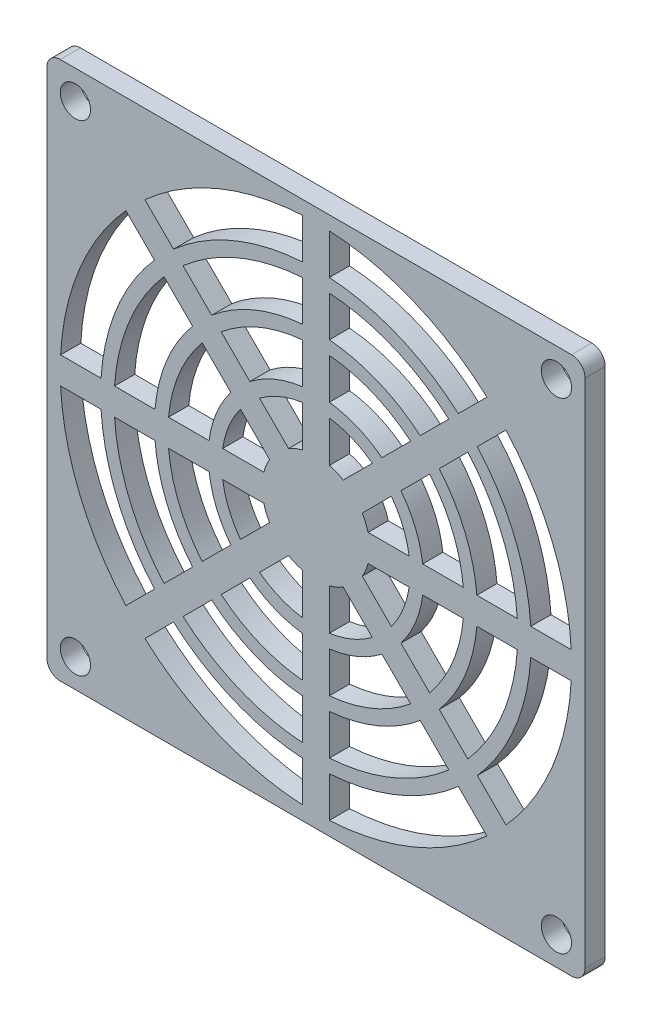
from build123d import *

# Parameters (mm, degrees)
SKETCH_1_R      = 2.25
EXTRUDE_1_DEPTH = 3


with BuildPart() as part:
    # 草图1 → 凸台-拉伸1 (new body)
    with BuildSketch(Plane.XY):
        with BuildLine():
            Line((-38, -40), (38, -40))
            ThreePointArc((38, -40), (39.414213562, -39.414213562), (40, -38))
            Line((40, -38), (40, 38))
            ThreePointArc((40, 38), (39.414213562, 39.414213562), (38, 40))
            Line((38, 40), (-38, 40))
            ThreePointArc((-38, 40), (-39.414213562, 39.414213562), (-40, 38))
            Line((-40, 38), (-40, -38))
            ThreePointArc((-40, -38), (-39.414213562, -39.414213562), (-38, -40))
        make_face()
        with Locations((-35.75, 35.75)):
            Circle(SKETCH_1_R, mode=Mode.SUBTRACT)
        with Locations((35.75, 35.75)):
            Circle(SKETCH_1_R, mode=Mode.SUBTRACT)
        with Locations((35.75, -35.75)):
            Circle(SKETCH_1_R, mode=Mode.SUBTRACT)
        with Locations((-35.75, -35.75)):
            Circle(SKETCH_1_R, mode=Mode.SUBTRACT)
        with BuildLine():
            Line((2, 37.947331922), (2, 31.937438845))
            ThreePointArc((2, 31.937438845), (12.245869836, 29.56414504), (21.168966019, 23.997393144))
            Line((21.168966019, 23.997393144), (25.418602168, 28.247029292))
            ThreePointArc((25.418602168, 28.247029292), (14.54197043, 35.107422235), (2, 37.947331922))
        make_face(mode=Mode.SUBTRACT)
        with BuildLine():
            Line((2, 29.933259094), (2, 23.916521486))
            ThreePointArc((2, 23.916521486), (9.184402377, 22.17310878), (15.497320963, 18.325748088))
            Line((15.497320963, 18.325748088), (19.751796926, 22.580224051))
            ThreePointArc((19.751796926, 22.580224051), (11.480502971, 27.716385975), (2, 29.933259094))
        make_face(mode=Mode.SUBTRACT)
        with BuildLine():
            Line((2, 21.9089023), (2, 15.874507866))
            ThreePointArc((2, 15.874507866), (6.122934918, 14.78207252), (9.810758598, 12.639185723))
            Line((9.810758598, 12.639185723), (14.077719822, 16.906146947))
            ThreePointArc((14.077719822, 16.906146947), (8.419035512, 20.325349715), (2, 21.9089023))
        make_face(mode=Mode.SUBTRACT)
        with BuildLine():
            Line((37.947331922, 2), (31.937438845, 2))
            ThreePointArc((31.937438845, 2), (29.56414504, 12.245869836), (23.997393144, 21.168966019))
            Line((23.997393144, 21.168966019), (28.247029292, 25.418602168))
            ThreePointArc((28.247029292, 25.418602168), (35.107422235, 14.54197043), (37.947331922, 2))
        make_face(mode=Mode.SUBTRACT)
        with BuildLine():
            Line((29.933259094, 2), (23.916521486, 2))
            ThreePointArc((23.916521486, 2), (22.17310878, 9.184402377), (18.325748088, 15.497320963))
            Line((18.325748088, 15.497320963), (22.580224051, 19.751796926))
            ThreePointArc((22.580224051, 19.751796926), (27.716385975, 11.480502971), (29.933259094, 2))
        make_face(mode=Mode.SUBTRACT)
        with BuildLine():
            Line((21.9089023, 2), (15.874507866, 2))
            ThreePointArc((15.874507866, 2), (14.78207252, 6.122934918), (12.639185723, 9.810758598))
            Line((12.639185723, 9.810758598), (16.906146947, 14.077719822))
            ThreePointArc((16.906146947, 14.077719822), (20.325349715, 8.419035512), (21.9089023, 2))
        make_face(mode=Mode.SUBTRACT)
        with BuildLine():
            Line((28.247029292, -25.418602168), (23.997393144, -21.168966019))
            ThreePointArc((23.997393144, -21.168966019), (29.56414504, -12.245869836), (31.937438845, -2))
            Line((31.937438845, -2), (37.947331922, -2))
            ThreePointArc((37.947331922, -2), (35.107422235, -14.54197043), (28.247029292, -25.418602168))
        make_face(mode=Mode.SUBTRACT)
        with BuildLine():
            Line((22.580224051, -19.751796926), (18.325748088, -15.497320963))
            ThreePointArc((18.325748088, -15.497320963), (22.17310878, -9.184402377), (23.916521486, -2))
            Line((23.916521486, -2), (29.933259094, -2))
            ThreePointArc((29.933259094, -2), (27.716385975, -11.480502971), (22.580224051, -19.751796926))
        make_face(mode=Mode.SUBTRACT)
        with BuildLine():
            Line((16.906146947, -14.077719822), (12.639185723, -9.810758598))
            ThreePointArc((12.639185723, -9.810758598), (14.78207252, -6.122934918), (15.874507866, -2))
            Line((15.874507866, -2), (21.9089023, -2))
            ThreePointArc((21.9089023, -2), (20.325349715, -8.419035512), (16.906146947, -14.077719822))
        make_face(mode=Mode.SUBTRACT)
        with BuildLine():
            Line((2, -37.947331922), (2, -31.937438845))
            ThreePointArc((2, -31.937438845), (12.245869836, -29.56414504), (21.168966019, -23.997393144))
            Line((21.168966019, -23.997393144), (25.418602168, -28.247029292))
            ThreePointArc((25.418602168, -28.247029292), (14.54197043, -35.107422235), (2, -37.947331922))
        make_face(mode=Mode.SUBTRACT)
        with BuildLine():
            Line((2, -29.933259094), (2, -23.916521486))
            ThreePointArc((2, -23.916521486), (9.184402377, -22.17310878), (15.497320963, -18.325748088))
            Line((15.497320963, -18.325748088), (19.751796926, -22.580224051))
            ThreePointArc((19.751796926, -22.580224051), (11.480502971, -27.716385975), (2, -29.933259094))
        make_face(mode=Mode.SUBTRACT)
        with BuildLine():
            Line((2, -21.9089023), (2, -15.874507866))
            ThreePointArc((2, -15.874507866), (6.122934918, -14.78207252), (9.810758598, -12.639185723))
            Line((9.810758598, -12.639185723), (14.077719822, -16.906146947))
            ThreePointArc((14.077719822, -16.906146947), (8.419035512, -20.325349715), (2, -21.9089023))
        make_face(mode=Mode.SUBTRACT)
        with BuildLine():
            Line((-25.418602168, -28.247029292), (-21.168966019, -23.997393144))
            ThreePointArc((-21.168966019, -23.997393144), (-12.245869836, -29.56414504), (-2, -31.937438845))
            Line((-2, -31.937438845), (-2, -37.947331922))
            ThreePointArc((-2, -37.947331922), (-14.54197043, -35.107422235), (-25.418602168, -28.247029292))
        make_face(mode=Mode.SUBTRACT)
        with BuildLine():
            Line((-19.751796926, -22.580224051), (-15.497320963, -18.325748088))
            ThreePointArc((-15.497320963, -18.325748088), (-9.184402377, -22.17310878), (-2, -23.916521486))
            Line((-2, -23.916521486), (-2, -29.933259094))
            ThreePointArc((-2, -29.933259094), (-11.480502971, -27.716385975), (-19.751796926, -22.580224051))
        make_face(mode=Mode.SUBTRACT)
        with BuildLine():
            Line((-14.077719822, -16.906146947), (-9.810758598, -12.639185723))
            ThreePointArc((-9.810758598, -12.639185723), (-6.122934918, -14.78207252), (-2, -15.874507866))
            Line((-2, -15.874507866), (-2, -21.9089023))
            ThreePointArc((-2, -21.9089023), (-8.419035512, -20.325349715), (-14.077719822, -16.906146947))
        make_face(mode=Mode.SUBTRACT)
        with BuildLine():
            Line((-37.947331922, -2), (-31.937438845, -2))
            ThreePointArc((-31.937438845, -2), (-29.56414504, -12.245869836), (-23.997393144, -21.168966019))
            Line((-23.997393144, -21.168966019), (-28.247029292, -25.418602168))
            ThreePointArc((-28.247029292, -25.418602168), (-35.107422235, -14.54197043), (-37.947331922, -2))
        make_face(mode=Mode.SUBTRACT)
        with BuildLine():
            Line((-29.933259094, -2), (-23.916521486, -2))
            ThreePointArc((-23.916521486, -2), (-22.17310878, -9.184402377), (-18.325748088, -15.497320963))
            Line((-18.325748088, -15.497320963), (-22.580224051, -19.751796926))
            ThreePointArc((-22.580224051, -19.751796926), (-27.716385975, -11.480502971), (-29.933259094, -2))
        make_face(mode=Mode.SUBTRACT)
        with BuildLine():
            Line((-21.9089023, -2), (-15.874507866, -2))
            ThreePointArc((-15.874507866, -2), (-14.78207252, -6.122934918), (-12.639185723, -9.810758598))
            Line((-12.639185723, -9.810758598), (-16.906146947, -14.077719822))
            ThreePointArc((-16.906146947, -14.077719822), (-20.325349715, -8.419035512), (-21.9089023, -2))
        make_face(mode=Mode.SUBTRACT)
        with BuildLine():
            Line((-28.247029292, 25.418602168), (-23.997393144, 21.168966019))
            ThreePointArc((-23.997393144, 21.168966019), (-29.56414504, 12.245869836), (-31.937438845, 2))
            Line((-31.937438845, 2), (-37.947331922, 2))
            ThreePointArc((-37.947331922, 2), (-35.107422235, 14.54197043), (-28.247029292, 25.418602168))
        make_face(mode=Mode.SUBTRACT)
        with BuildLine():
            Line((-22.580224051, 19.751796926), (-18.325748088, 15.497320963))
            ThreePointArc((-18.325748088, 15.497320963), (-22.17310878, 9.184402377), (-23.916521486, 2))
            Line((-23.916521486, 2), (-29.933259094, 2))
            ThreePointArc((-29.933259094, 2), (-27.716385975, 11.480502971), (-22.580224051, 19.751796926))
        make_face(mode=Mode.SUBTRACT)
        with BuildLine():
            Line((-16.906146947, 14.077719822), (-12.639185723, 9.810758598))
            ThreePointArc((-12.639185723, 9.810758598), (-14.78207252, 6.122934918), (-15.874507866, 2))
            Line((-15.874507866, 2), (-21.9089023, 2))
            ThreePointArc((-21.9089023, 2), (-20.325349715, 8.419035512), (-16.906146947, 14.077719822))
        make_face(mode=Mode.SUBTRACT)
        with BuildLine():
            Line((-2, 37.947331922), (-2, 31.937438845))
            ThreePointArc((-2, 31.937438845), (-12.245869836, 29.56414504), (-21.168966019, 23.997393144))
            Line((-21.168966019, 23.997393144), (-25.418602168, 28.247029292))
            ThreePointArc((-25.418602168, 28.247029292), (-14.54197043, 35.107422235), (-2, 37.947331922))
        make_face(mode=Mode.SUBTRACT)
        with BuildLine():
            Line((-2, 29.933259094), (-2, 23.916521486))
            ThreePointArc((-2, 23.916521486), (-9.184402377, 22.17310878), (-15.497320963, 18.325748088))
            Line((-15.497320963, 18.325748088), (-19.751796926, 22.580224051))
            ThreePointArc((-19.751796926, 22.580224051), (-11.480502971, 27.716385975), (-2, 29.933259094))
        make_face(mode=Mode.SUBTRACT)
        with BuildLine():
            Line((-2, 21.9089023), (-2, 15.874507866))
            ThreePointArc((-2, 15.874507866), (-6.122934918, 14.78207252), (-9.810758598, 12.639185723))
            Line((-9.810758598, 12.639185723), (-14.077719822, 16.906146947))
            ThreePointArc((-14.077719822, 16.906146947), (-8.419035512, 20.325349715), (-2, 21.9089023))
        make_face(mode=Mode.SUBTRACT)
        with BuildLine():
            Line((8.383745409, 11.212172534), (4.063012013, 6.891439137))
            ThreePointArc((4.063012013, 6.891439137), (3.061467459, 7.39103626), (2, 7.745966692))
            Line((2, 7.745966692), (2, 13.856406461))
            ThreePointArc((2, 13.856406461), (5.357568053, 12.934313455), (8.383745409, 11.212172534))
        make_face(mode=Mode.SUBTRACT)
        with BuildLine():
            Line((11.212172534, 8.383745409), (6.891439137, 4.063012013))
            ThreePointArc((6.891439137, 4.063012013), (7.39103626, 3.061467459), (7.745966692, 2))
            Line((7.745966692, 2), (13.856406461, 2))
            ThreePointArc((13.856406461, 2), (12.934313455, 5.357568053), (11.212172534, 8.383745409))
        make_face(mode=Mode.SUBTRACT)
        with BuildLine():
            Line((13.856406461, -2), (7.745966692, -2))
            ThreePointArc((7.745966692, -2), (7.39103626, -3.061467459), (6.891439137, -4.063012013))
            Line((6.891439137, -4.063012013), (11.212172534, -8.383745409))
            ThreePointArc((11.212172534, -8.383745409), (12.934313455, -5.357568053), (13.856406461, -2))
        make_face(mode=Mode.SUBTRACT)
        with BuildLine():
            Line((8.383745409, -11.212172534), (4.063012013, -6.891439137))
            ThreePointArc((4.063012013, -6.891439137), (3.061467459, -7.39103626), (2, -7.745966692))
            Line((2, -7.745966692), (2, -13.856406461))
            ThreePointArc((2, -13.856406461), (5.357568053, -12.934313455), (8.383745409, -11.212172534))
        make_face(mode=Mode.SUBTRACT)
        with BuildLine():
            Line((-2, -13.856406461), (-2, -7.745966692))
            ThreePointArc((-2, -7.745966692), (-3.061467459, -7.39103626), (-4.063012013, -6.891439137))
            Line((-4.063012013, -6.891439137), (-8.383745409, -11.212172534))
            ThreePointArc((-8.383745409, -11.212172534), (-5.357568053, -12.934313455), (-2, -13.856406461))
        make_face(mode=Mode.SUBTRACT)
        with BuildLine():
            Line((-11.212172534, -8.383745409), (-6.891439137, -4.063012013))
            ThreePointArc((-6.891439137, -4.063012013), (-7.39103626, -3.061467459), (-7.745966692, -2))
            Line((-7.745966692, -2), (-13.856406461, -2))
            ThreePointArc((-13.856406461, -2), (-12.934313455, -5.357568053), (-11.212172534, -8.383745409))
        make_face(mode=Mode.SUBTRACT)
        with BuildLine():
            Line((-13.856406461, 2), (-7.745966692, 2))
            ThreePointArc((-7.745966692, 2), (-7.39103626, 3.061467459), (-6.891439137, 4.063012013))
            Line((-6.891439137, 4.063012013), (-11.212172534, 8.383745409))
            ThreePointArc((-11.212172534, 8.383745409), (-12.934313455, 5.357568053), (-13.856406461, 2))
        make_face(mode=Mode.SUBTRACT)
        with BuildLine():
            Line((-8.383745409, 11.212172534), (-4.063012013, 6.891439137))
            ThreePointArc((-4.063012013, 6.891439137), (-3.061467459, 7.39103626), (-2, 7.745966692))
            Line((-2, 7.745966692), (-2, 13.856406461))
            ThreePointArc((-2, 13.856406461), (-5.357568053, 12.934313455), (-8.383745409, 11.212172534))
        make_face(mode=Mode.SUBTRACT)
    extrude(amount=EXTRUDE_1_DEPTH)


solid = part.part
